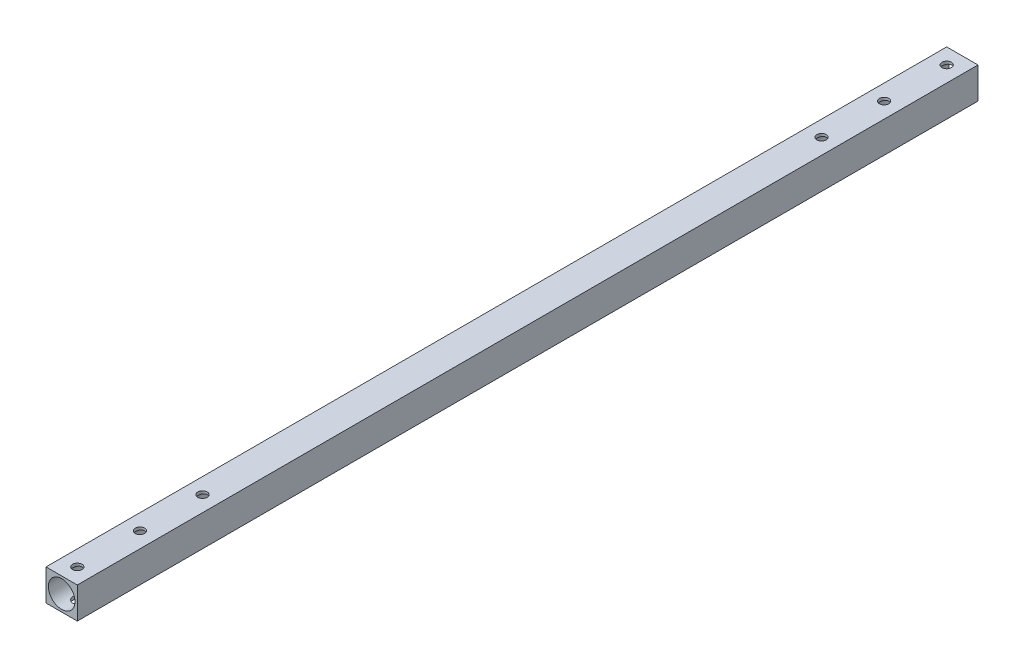
from build123d import *

# Parameters (mm, degrees)
SKETCH1_W           = 10
SKETCH1_H           = 10
SKETCH1_R           = 4.25
BOSS_EXTRUDE1_DEPTH = 287.8
SKETCH2_R           = 1.5
CUT_EXTRUDE1_DEPTH  = 289.017082827


with BuildPart() as part:
    # Sketch1 → Boss-Extrude1 (new body)
    with BuildSketch(Plane.XY):
        Rectangle(SKETCH1_W, SKETCH1_H)
        Circle(SKETCH1_R, mode=Mode.SUBTRACT)
    extrude(amount=BOSS_EXTRUDE1_DEPTH)

    # Sketch2 → Cut-Extrude1 (cut, through all)
    with BuildSketch(Plane(origin=(0, 5, 0), x_dir=(1, 0, 0), z_dir=(0, 1, 0))):
        with Locations(Location((0, -5, 0), (0, 0, 270))):
            Circle(SKETCH2_R)
        with Locations(Location((0, -25, 0), (0, 0, 270))):
            Circle(SKETCH2_R)
        with Locations(Location((0, -45, 0), (0, 0, 270))):
            Circle(SKETCH2_R)
        with Locations(Location((0, -282.8, 0), (0, 0, 270))):
            Circle(SKETCH2_R)
        with Locations(Location((0, -262.8, 0), (0, 0, 270))):
            Circle(SKETCH2_R)
        with Locations(Location((0, -242.8, 0), (0, 0, 270))):
            Circle(SKETCH2_R)
    extrude(amount=-CUT_EXTRUDE1_DEPTH, mode=Mode.SUBTRACT)


solid = part.part
